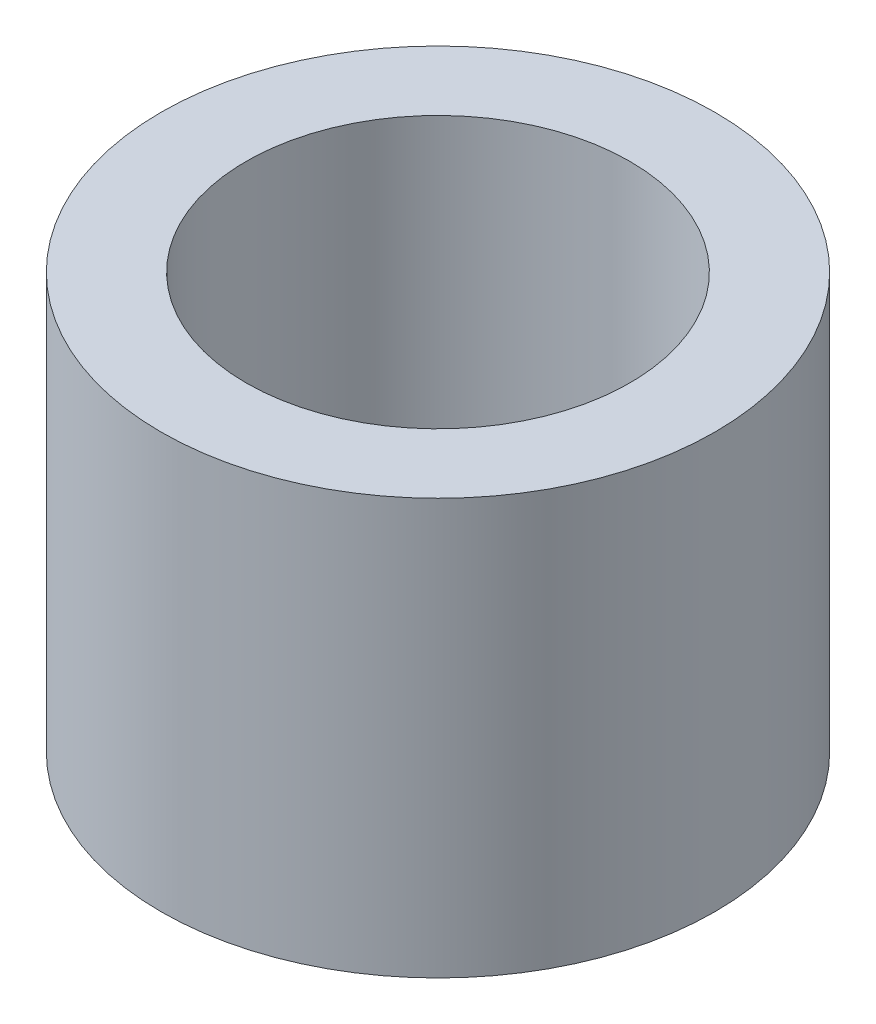
from build123d import *

# Parameters (mm, degrees)
ESBO_O1_R                = 3.175
ESBO_O1_R_2              = 2.2
RESSALTO_EXTRUS_O1_DEPTH = 4.7625


with BuildPart() as part:
    # Esboço1 → Ressalto-extrusão1 (new body)
    with BuildSketch(Plane(origin=(0, 0, 0), x_dir=(1, 0, 0), z_dir=(0, 1, 0))):
        with Locations(Location((0, 0, 0), (0, 0, 90))):
            Circle(ESBO_O1_R)
        with Locations(Location((0, 0, 0), (0, 0, 90))):
            Circle(ESBO_O1_R_2, mode=Mode.SUBTRACT)
    extrude(amount=RESSALTO_EXTRUS_O1_DEPTH)


solid = part.part
